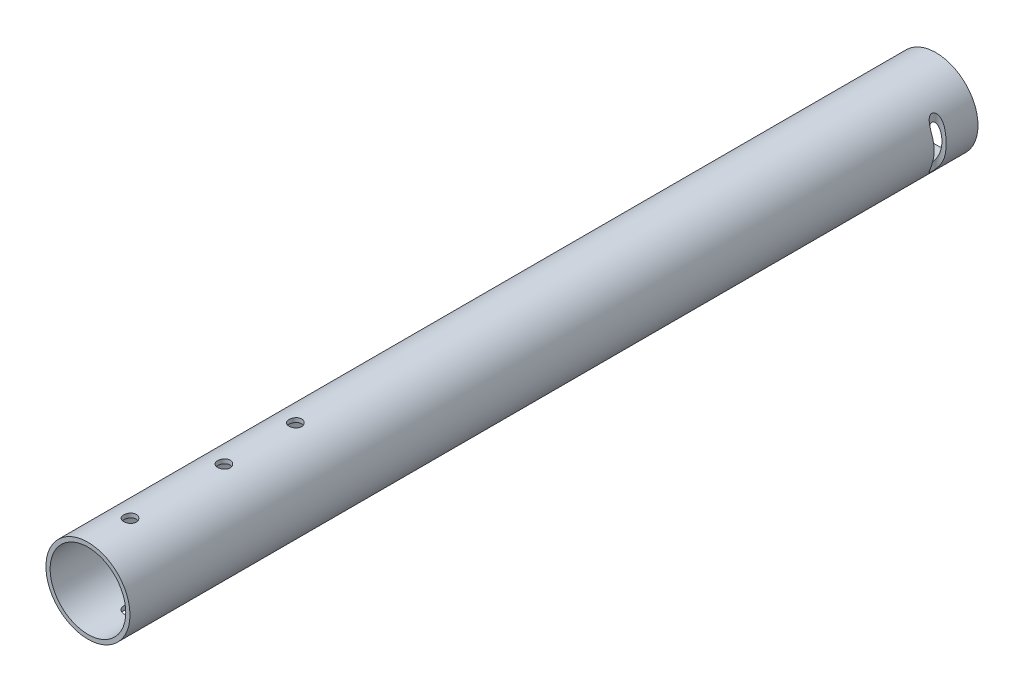
from build123d import *

# Parameters (mm, degrees)
SKETCH_1_R          = 10
SKETCH_1_R_2        = 9
EXTRUDE_1_DEPTH     = 201.8
SKETCH_2_R          = 1.5
CUT_EXTRUDE_1_DEPTH = 15
SKETCH_3_W          = 15
SKETCH_3_H          = 7
CUT_EXTRUDE_2_DEPTH = 10


with BuildPart() as part:
    # 草图1 → 拉伸-薄壁1 (new body)
    with BuildSketch(Plane.XY):
        Circle(SKETCH_1_R)
        Circle(SKETCH_1_R_2, mode=Mode.SUBTRACT)
    extrude(amount=EXTRUDE_1_DEPTH)

    # 草图2 → 切除-拉伸1 (cut, symmetric)
    with BuildSketch(Plane(origin=(0, 0, 0), x_dir=(1, 0, 0), z_dir=(0, 1, 0))):
        with Locations(Location((0, -152.46, 0), (0, 0, 270))):
            Circle(SKETCH_2_R)
        with Locations(Location((0, -169.46, 0), (0, 0, 270))):
            Circle(SKETCH_2_R)
        with Locations(Location((0, -191.8, 0), (0, 0, 270))):
            Circle(SKETCH_2_R)
        with Locations((-9.5, -9)):
            Circle(SKETCH_2_R)
        with Locations((9.5, -9)):
            Circle(SKETCH_2_R)
    extrude(amount=CUT_EXTRUDE_1_DEPTH, both=True, mode=Mode.SUBTRACT)

    # 草图3 → 切除-拉伸2 (cut)
    with BuildSketch(Plane(origin=(0, 0, 0), x_dir=(0, 0, -1), z_dir=(1, 0, 0))):
        with Locations((-100.9, 0)):
            Rectangle(SKETCH_3_W, SKETCH_3_H)
    extrude(amount=-CUT_EXTRUDE_2_DEPTH, mode=Mode.SUBTRACT)


solid = part.part
